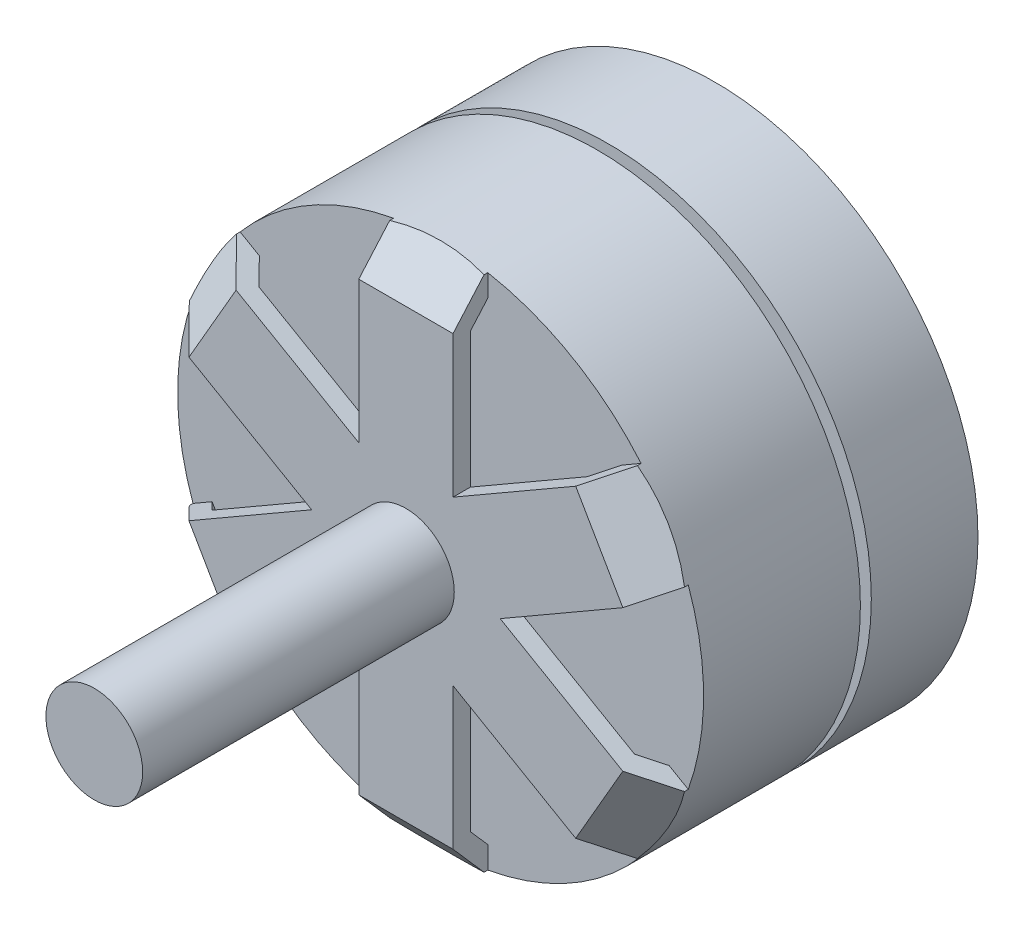
from build123d import *

# Parameters (mm, degrees)
SKETCH1_R           = 13.462
BOSS_EXTRUDE1_DEPTH = 5.461
SKETCH2_R           = 2.4765
BOSS_EXTRUDE2_DEPTH = 26.3144
SKETCH3_R           = 13.462
BOSS_EXTRUDE3_DEPTH = 8.0264
BOSS_EXTRUDE4_DEPTH = 2.413
CIRPATTERN1_COUNT   = 3
SKETCH5_R           = 15.79013095
SKETCH5_R_2         = 13.462
CUT_EXTRUDE1_DEPTH  = 0.190772


with BuildPart() as part:
    # Sketch1 → Boss-Extrude1 (new body)
    with BuildSketch(Plane.XY):
        Circle(SKETCH1_R)
    extrude(amount=BOSS_EXTRUDE1_DEPTH)

    # Sketch2 → Boss-Extrude2 (add)
    with BuildSketch(Plane.XY.offset(5.461)):
        Circle(SKETCH2_R)
    extrude(amount=BOSS_EXTRUDE2_DEPTH)

    # Sketch3 → Boss-Extrude3 (add)
    with BuildSketch(Plane.XY.offset(6.0198)):
        Circle(SKETCH3_R)
    extrude(amount=BOSS_EXTRUDE3_DEPTH)

    # Sketch4 → Boss-Extrude4 (add, symmetric)
    with BuildSketch(Plane(origin=(0, 0, 0), x_dir=(0, 0, -1), z_dir=(1, 0, 0))):
        Polygon((-14.0462, 13.462), (-15.8242, 11.43), (-15.8242, -11.43), (-14.0462, -13.462), (-14.0462, -12.111971482), (-14.9352, -11.095971482), (-14.9352, 11.095971482), (-14.0462, 12.111971482), align=None)
    boss_extrude4 = extrude(amount=BOSS_EXTRUDE4_DEPTH, both=True)

    # CirPattern1: Boss-Extrude4 ×3 about axis
    cirpattern1_axis = Axis((0, 0, 0), (0, 0, 1))
    for i in range(1, CIRPATTERN1_COUNT):
        add(boss_extrude4.rotate(cirpattern1_axis, i * 360 / CIRPATTERN1_COUNT))

    # Sketch5 → Cut-Extrude1 (cut)
    with BuildSketch(Plane.XY.offset(14.0462)):
        Circle(SKETCH5_R)
        Circle(SKETCH5_R_2, mode=Mode.SUBTRACT)
    extrude(amount=CUT_EXTRUDE1_DEPTH, mode=Mode.SUBTRACT)


solid = part.part
